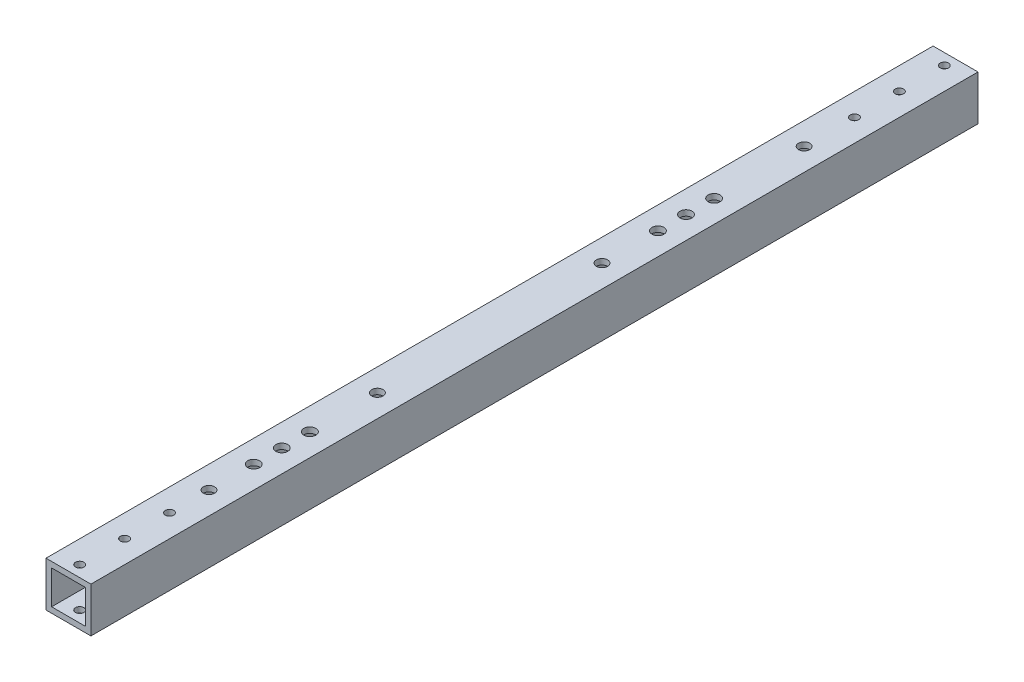
from build123d import *

# Parameters (mm, degrees)
SKETCH1_W                       = 25.4
SKETCH1_H                       = 25.4
SKETCH1_W_2                     = 19.05
SKETCH1_H_2                     = 19.05
EXTRUDE_THIN1_DEPTH             = 501.65
F_3_16_0_1875_DIAMETER_HOLE1_D  = 4.7625
F_1_4_0_25_DIAMETER_HOLE1_D     = 6.35
F_1_4_0_25_DIAMETER_HOLE1_DEPTH = 25.4
F_1_4_0_25_DIAMETER_HOLE1_TIP   = 1.907732465
F_1_4_CLEARANCE_HOLE1_D         = 6.7564
F_1_4_CLEARANCE_HOLE1_DEPTH     = 38.1
F_1_4_CLEARANCE_HOLE1_TIP       = 2.029827343


with BuildPart() as part:
    # Sketch1 → Extrude-Thin1 (new body)
    with BuildSketch(Plane.XY):
        Rectangle(SKETCH1_W, SKETCH1_H)
        Rectangle(SKETCH1_W_2, SKETCH1_H_2, mode=Mode.SUBTRACT)
    extrude(amount=EXTRUDE_THIN1_DEPTH)

    # 3/16 (0.1875) Diameter Hole1 (through all)
    with Locations(Plane(origin=(0, 12.7, 495.3), x_dir=(0, 0, 1), z_dir=(0, 1, 0))):
        with Locations((0, 0), (-488.95, 0), (-463.55, 0), (-438.15, 0), (-25.4, 0), (-50.8, 0)):
            Hole(F_3_16_0_1875_DIAMETER_HOLE1_D / 2)

    # 1/4 (0.25) Diameter Hole1
    with Locations(Plane(origin=(0, 12.7, 0), x_dir=(1, 0, 0), z_dir=(0, 1, 0))):
        with Locations((0, -199.933463093), (0, -422.2), (0, -326.95), (0, -85.623539829)):
            Hole(F_1_4_0_25_DIAMETER_HOLE1_D / 2, depth=F_1_4_0_25_DIAMETER_HOLE1_DEPTH)
            with Locations((0, 0, -(F_1_4_0_25_DIAMETER_HOLE1_DEPTH + F_1_4_0_25_DIAMETER_HOLE1_TIP / 2))):  # 118° drill point
                Cone(0, F_1_4_0_25_DIAMETER_HOLE1_D / 2, F_1_4_0_25_DIAMETER_HOLE1_TIP, mode=Mode.SUBTRACT)

    # 1/4 Clearance Hole1
    with Locations(Plane(origin=(-381, 12.7, 250.825), x_dir=(1, 0, 0), z_dir=(0, 1, 0))):
        with Locations((381, 82.55), (381, 98.425), (381, 114.3), (381, -146.05), (381, -130.175), (381, -114.3), (-381, -146.05), (-381, -130.175), (-381, -114.3), (-381, 82.55), (-381, 98.425), (-381, 114.3)):
            Hole(F_1_4_CLEARANCE_HOLE1_D / 2, depth=F_1_4_CLEARANCE_HOLE1_DEPTH)
            with Locations((0, 0, -(F_1_4_CLEARANCE_HOLE1_DEPTH + F_1_4_CLEARANCE_HOLE1_TIP / 2))):  # 118° drill point
                Cone(0, F_1_4_CLEARANCE_HOLE1_D / 2, F_1_4_CLEARANCE_HOLE1_TIP, mode=Mode.SUBTRACT)


solid = part.part
